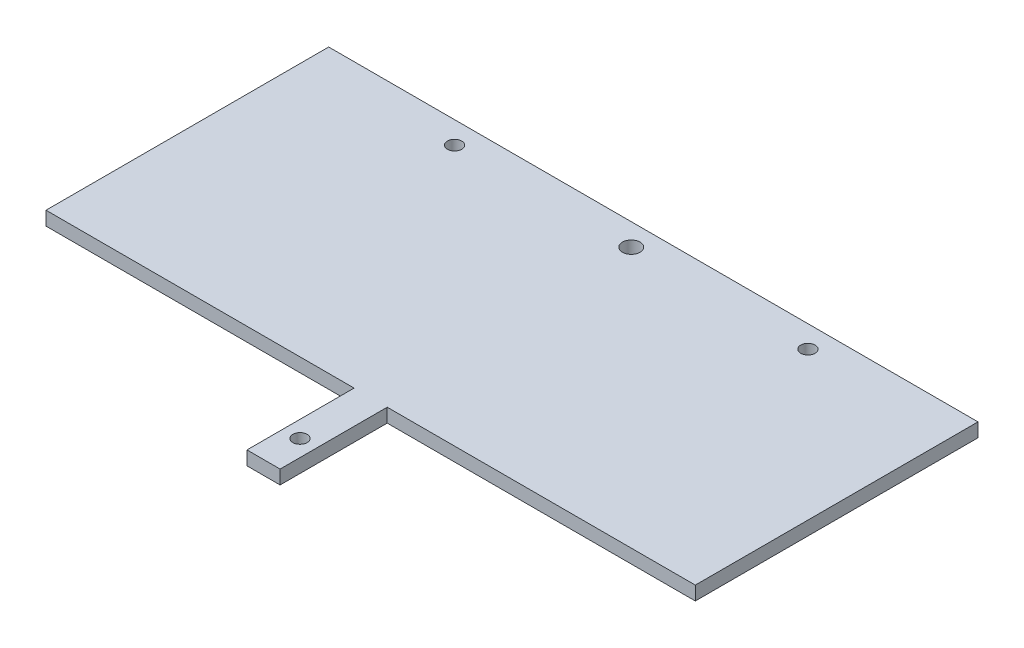
from build123d import *

# Parameters (mm, degrees)
BOSS_EXTRUDE1_DEPTH = 3.175
SKETCH2_R           = 1.651
SKETCH2_R_2         = 2.032
CUT_EXTRUDE1_DEPTH  = 89.969731937


with BuildPart() as part:
    # Sketch1 → Boss-Extrude1 (new body)
    with BuildSketch(Plane(origin=(0, 0, 0), x_dir=(1, 0, 0), z_dir=(0, 1, 0))):
        Polygon((-74.676, 41.402), (74.676, 41.402), (74.676, -23.622), (3.81, -23.622), (3.81, -48.26), (-3.81, -48.26), (-3.81, -23.622), (-74.676, -23.622), align=None)
    extrude(amount=-BOSS_EXTRUDE1_DEPTH)

    # Sketch2 → Cut-Extrude1 (cut, through all)
    with BuildSketch(Plane(origin=(0, 0, 0), x_dir=(1, 0, 0), z_dir=(0, 1, 0))):
        with Locations(Location((-40.64, 36.322, 0), (0, 0, 270))):
            Circle(SKETCH2_R)
        with Locations(Location((0, 36.322, 0), (0, 0, 270))):
            Circle(SKETCH2_R_2)
        with Locations(Location((40.64, 36.322, 0), (0, 0, 270))):
            Circle(SKETCH2_R)
        with Locations(Location((0, -39.878, 0), (0, 0, 270))):
            Circle(SKETCH2_R)
    extrude(amount=-CUT_EXTRUDE1_DEPTH, mode=Mode.SUBTRACT)


solid = part.part
